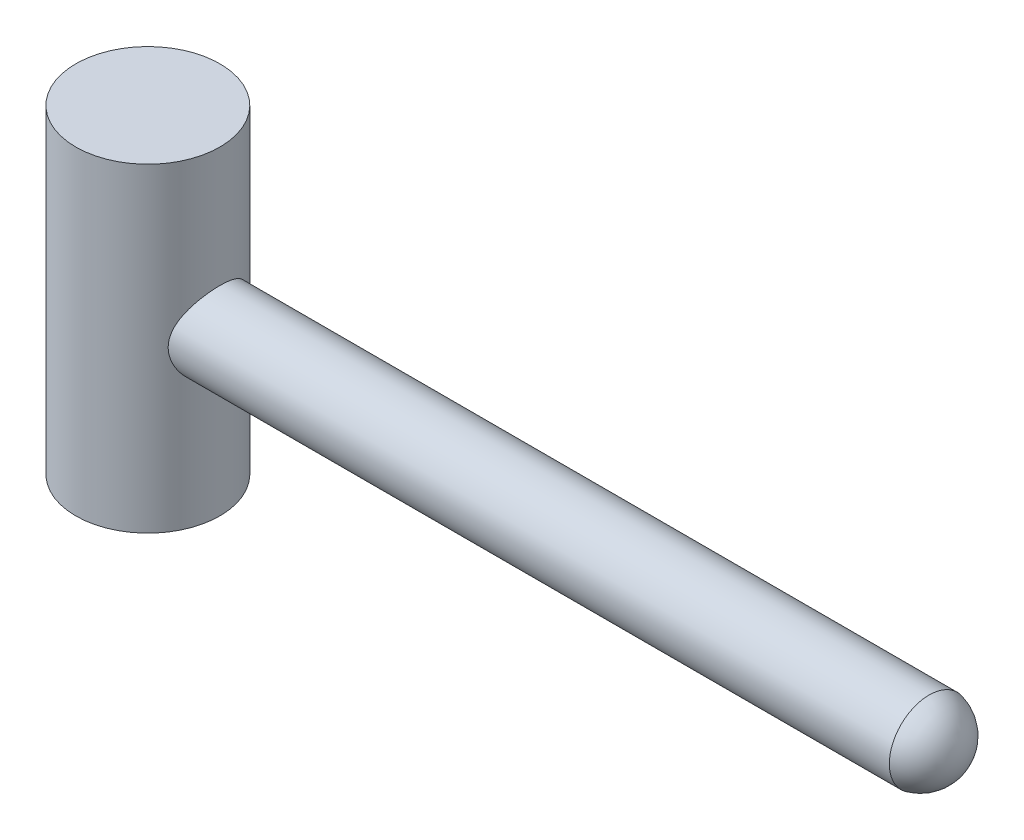
from build123d import *

# Parameters (mm, degrees)
SKETCH2_R                = 11.4427
BOSS_EXTRUDE1_DEPTH      = 50.7111
BOSS_EXTRUDE2_REACH      = 179.231
BOSS_EXTRUDE2_END_RADIUS = 11.4427
BOSS_EXTRUDE2_START      = 124
SKETCH3_R                = 6.31825
DOME1_FACE_RADIUS        = 6.31825
DOME1_HEIGHT             = 5.08


with BuildPart() as part:
    # Sketch2 → Boss-Extrude1 (new body)
    with BuildSketch(Plane(origin=(0, 0, 0), x_dir=(1, 0, 0), z_dir=(0, 1, 0))):
        with Locations(Location((0, 0, 0), (0, 0, 270))):
            Circle(SKETCH2_R)
    extrude(amount=BOSS_EXTRUDE1_DEPTH)


with BuildPart() as body_2:
    # Boss-Extrude2: up to this cylinder (the profile starts outside it)
    boss_extrude2_end = Plane(origin=(0, 25.35555, 0), z_dir=(0, -1, 0)) * Cylinder(BOSS_EXTRUDE2_END_RADIUS, 382.3474, mode=Mode.PRIVATE)
    # Sketch3 → Boss-Extrude2 (new, up to the surface)
    with BuildSketch(Plane(origin=(0, 0, 0), x_dir=(0, 0, -1), z_dir=(1, 0, 0)).offset(BOSS_EXTRUDE2_START), mode=Mode.PRIVATE) as boss_extrude2_sk1:
        with Locations((0, 25.35555)):
            Circle(SKETCH3_R)
    boss_extrude2_tool1 = extrude(boss_extrude2_sk1.sketch, amount=-BOSS_EXTRUDE2_REACH, mode=Mode.PRIVATE) - boss_extrude2_end
    add(boss_extrude2_tool1.solids().sort_by_distance((124, 25.35555, 0))[0])

    # Dome1: a dome of height H over a round flat face of radius A is a cap of a sphere of radius (A * A + H * H) / (2 * H)
    dome1_r = (DOME1_FACE_RADIUS * DOME1_FACE_RADIUS + DOME1_HEIGHT * DOME1_HEIGHT) / (2 * DOME1_HEIGHT)
    dome1_base = Plane((124, 25.35555, 0), z_dir=(1, 0, 0))
    with Locations(dome1_base.offset(DOME1_HEIGHT - dome1_r)):
        dome1_ball = Sphere(dome1_r, mode=Mode.PRIVATE)
    add(split(dome1_ball, bisect_by=dome1_base, keep=Keep.TOP, mode=Mode.PRIVATE))


solid = Compound([part.part, body_2.part])
